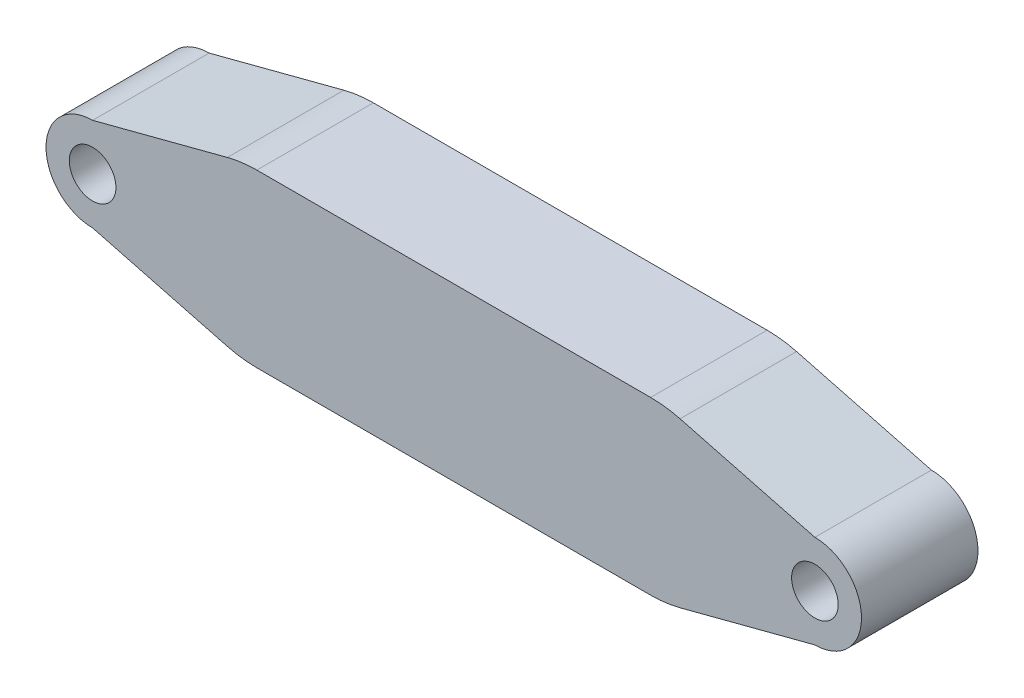
from build123d import *

# Parameters (mm, degrees)
CROQUIS1_R              = 2
SALIENTE_EXTRUIR1_DEPTH = 10
REDONDEO2_R             = 10


with BuildPart() as part:
    # Croquis1 → Saliente-Extruir1 (new body)
    with BuildSketch(Plane.XY):
        with BuildLine():
            Line((12.815, 7.35), (49.185, 7.35))
            Line((49.185, 7.35), (62, 4))
            ThreePointArc((62, 4), (66, 0), (62, -4))
            Line((62, -4), (49.185, -7.35))
            Line((49.185, -7.35), (12.815, -7.35))
            Line((12.815, -7.35), (0, -4))
            ThreePointArc((0, -4), (-4, 0), (0, 4))
            Line((0, 4), (12.815, 7.35))
        make_face()
        Circle(CROQUIS1_R, mode=Mode.SUBTRACT)
        with Locations((62, 0)):
            Circle(CROQUIS1_R, mode=Mode.SUBTRACT)
    extrude(amount=SALIENTE_EXTRUIR1_DEPTH)

    # Redondeo2
    redondeo2_edges = [part.edges().sort_by_distance(p)[0] for p in [
        (12.815, 7.35, 5),
        (49.185, 7.35, 5),
        (49.185, -7.35, 5),
        (12.815, -7.35, 5),
    ]]
    fillet(redondeo2_edges, radius=REDONDEO2_R)


solid = part.part
